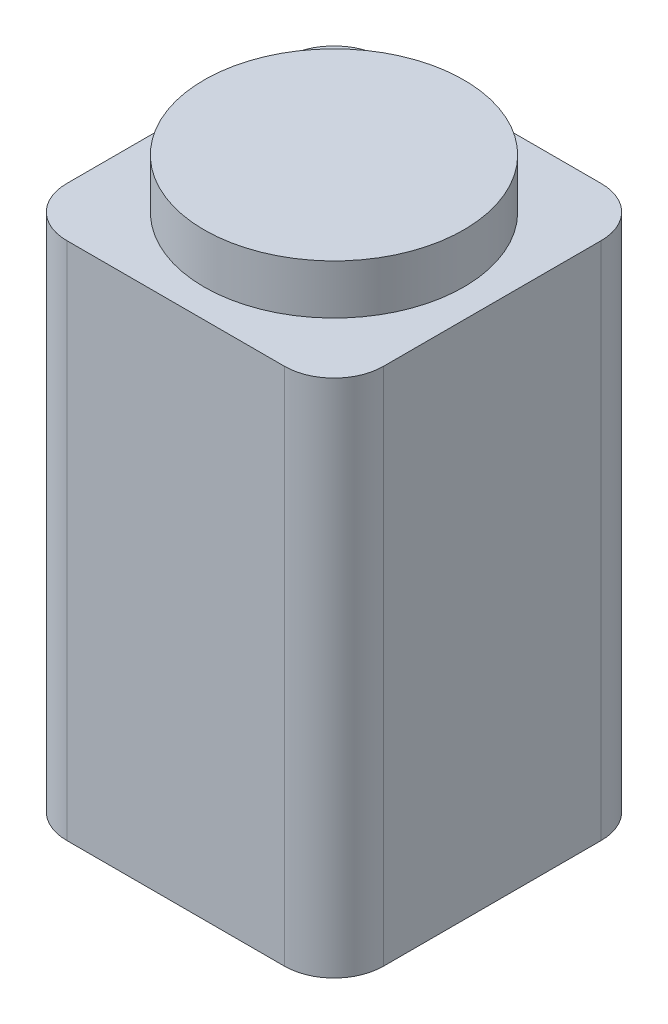
from build123d import *

# Parameters (mm, degrees)
BOSS_EXTRUDE1_DEPTH = 210
SKETCH2_R           = 52.5
BOSS_EXTRUDE2_DEPTH = 20


with BuildPart() as part:
    # Sketch1 → Boss-Extrude1 (new body)
    with BuildSketch(Plane(origin=(0, 0, 0), x_dir=(1, 0, 0), z_dir=(0, 1, 0))):
        with BuildLine():
            Line((-20, 0), (-108, 0))
            ThreePointArc((-108, 0), (-122.142135624, -5.857864376), (-128, -20))
            Line((-128, -20), (-128, -108))
            ThreePointArc((-128, -108), (-122.142135624, -122.142135624), (-108, -128))
            Line((-108, -128), (-20, -128))
            ThreePointArc((-20, -128), (-5.857864376, -122.142135624), (0, -108))
            Line((0, -108), (0, -20))
            ThreePointArc((0, -20), (-5.857864376, -5.857864376), (-20, 0))
        make_face()
    extrude(amount=BOSS_EXTRUDE1_DEPTH)

    # Sketch2 → Boss-Extrude2 (add)
    with BuildSketch(Plane(origin=(0, 210, 0), x_dir=(1, 0, 0), z_dir=(0, 1, 0))):
        with Locations(Location((-64, -64, 0), (0, 0, 270))):
            Circle(SKETCH2_R)
    extrude(amount=BOSS_EXTRUDE2_DEPTH)


solid = part.part
